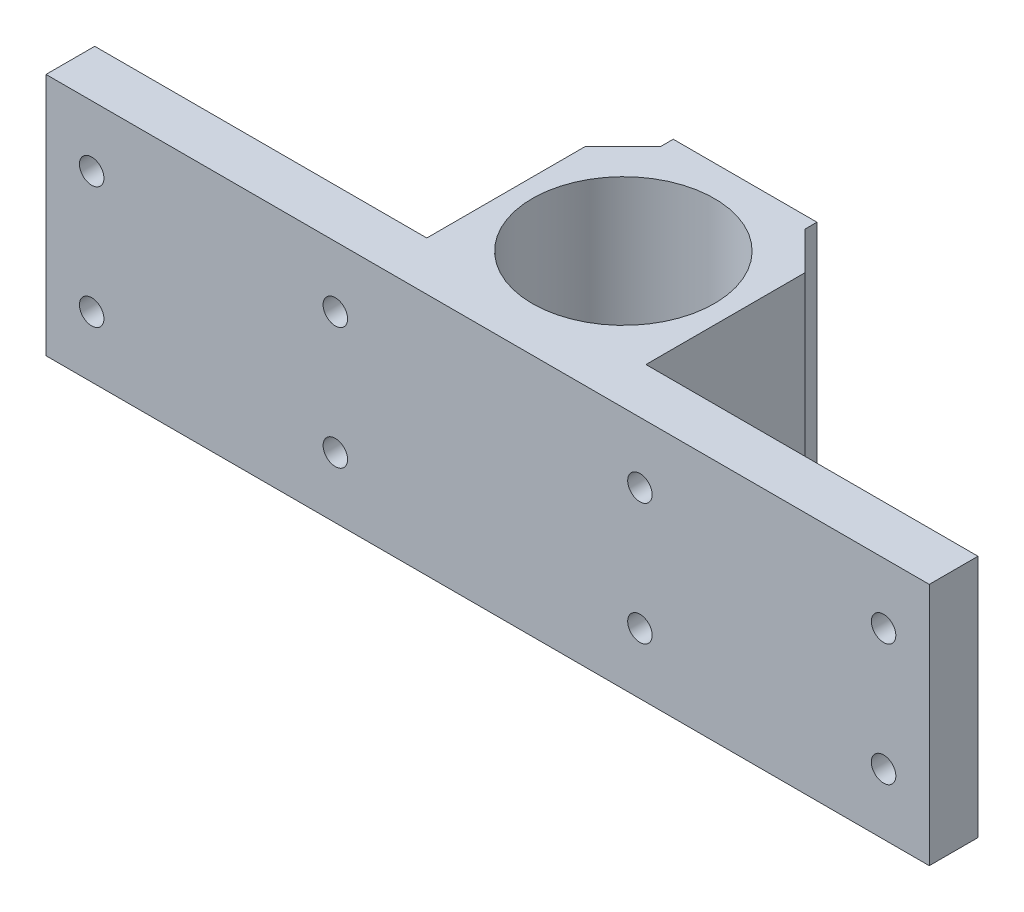
from build123d import *

# Parameters (mm, degrees)
SKETCH1_W                           = 184.15
SKETCH1_H                           = 50.8
BOSS_EXTRUDE1_DEPTH                 = 10.16
CUT_EXTRUDE1_DEPTH                  = 110.402922012
CUT_EXTRUDE1_DEPTH_BACK             = 110.402922012
SKETCH7_R                           = 22.847252038
BOSS_EXTRUDE2_DEPTH                 = 50.8
SKETCH8_R                           = 18.9865
CUT_EXTRUDE2_DEPTH                  = 45.72
SKETCH9_R                           = 7.9375
CUT_EXTRUDE3_DEPTH                  = 115.259711281
BOSS_EXTRUDE3_DEPTH                 = 50.8
BOSS_EXTRUDE4_START                 = -50.8
BOSS_EXTRUDE4_DEPTH                 = 50.8
BOSS_EXTRUDE5_START                 = -50.8
BOSS_EXTRUDE5_DEPTH                 = 50.8
CUT_EXTRUDE6_DEPTH                  = 117.385579957
F_10_CLEARANCE_HOLE1_D              = 5.1054
F_10_CLEARANCE_HOLE2_D              = 5.1054
SKETCH31_W                          = 29.960646913
SKETCH31_H                          = 50.8
BOSS_EXTRUDE6_DEPTH                 = 2.54
F_3_16_0_1875_DIAMETER_HOLE3_REACH  = 132.668
F_3_16_0_1875_DIAMETER_HOLE3_BORE_R = 2.38125
F_3_16_0_1875_DIAMETER_HOLE4_REACH  = 129.945
F_3_16_0_1875_DIAMETER_HOLE4_BORE_R = 2.38125


with BuildPart() as part:
    # Sketch1 → Boss-Extrude1 (new body)
    with BuildSketch(Plane.XY):
        with Locations((4.284398839, -3.653036721)):
            Rectangle(SKETCH1_W, SKETCH1_H)
    extrude(amount=BOSS_EXTRUDE1_DEPTH)

    # Sketch6 → Cut-Extrude1 (cut, two sides: drawn at the far end of the back side and taken through both)
    with BuildSketch(Plane(origin=(0, 21.746963279, 0), x_dir=(1, 0, 0), z_dir=(0, 1, 0)).offset(-CUT_EXTRUDE1_DEPTH_BACK)):
        with BuildLine():
            Line((189.051531618, 108.11571126), (10.888398839, 0))
            ThreePointArc((10.888398839, 0), (4.284398839, -1.847030056), (-2.319601161, 0))
            Line((-2.319601161, 0), (-180.48273394, 108.11571126))
            Line((-180.48273394, 108.11571126), (-180.48273394, 524.918345142))
            Line((-180.48273394, 524.918345142), (189.051531618, 524.918345142))
            Line((189.051531618, 524.918345142), (189.051531618, 108.11571126))
        make_face()
    extrude(amount=CUT_EXTRUDE1_DEPTH + CUT_EXTRUDE1_DEPTH_BACK, mode=Mode.SUBTRACT)

    # Sketch7 → Boss-Extrude2 (add, through all)
    with BuildSketch(Plane(origin=(0, 21.746963279, 0), x_dir=(1, 0, 0), z_dir=(0, 1, 0))):
        with Locations((4.284398839, 18.138470809)):
            Circle(SKETCH7_R)
    extrude(amount=-BOSS_EXTRUDE2_DEPTH)

    # Sketch8 → Cut-Extrude2 (cut)
    with BuildSketch(Plane(origin=(0, 21.746963279, 0), x_dir=(1, 0, 0), z_dir=(0, 1, 0))):
        with Locations(Location((4.284398839, 18.138470809, 0), (0, 0, 270))):
            Circle(SKETCH8_R)
    extrude(amount=-CUT_EXTRUDE2_DEPTH, mode=Mode.SUBTRACT)

    # Sketch9 → Cut-Extrude3 (cut, through all)
    with BuildSketch(Plane(origin=(0, -23.973036721, 0), x_dir=(1, 0, 0), z_dir=(0, 1, 0))):
        with Locations(Location((4.284398839, 18.138470809, 0), (0, 0, 270))):
            Circle(SKETCH9_R)
    extrude(amount=-CUT_EXTRUDE3_DEPTH, mode=Mode.SUBTRACT)

    # Sketch12 → Boss-Extrude3 (add)
    with BuildSketch(Plane(origin=(0, 21.746963279, 0), x_dir=(1, 0, 0), z_dir=(0, 1, 0))):
        with BuildLine():
            Line((27.131650877, 18.138470763), (27.131650877, 0))
            Line((27.131650877, 0), (18.176583779, 0))
            ThreePointArc((18.176583779, 0), (24.770920949, 8.024157287), (27.131650877, 18.138470763))
        make_face()
        with BuildLine():
            Line((-18.562853199, 18.138470775), (-18.562853199, 0))
            Line((-18.562853199, 0), (-9.607786101, 0))
            ThreePointArc((-9.607786101, 0), (-16.202123271, 8.024157294), (-18.562853199, 18.138470775))
        make_face()
    extrude(amount=-BOSS_EXTRUDE3_DEPTH)

    # Sketch16 → Boss-Extrude4 (add)
    with BuildSketch(Plane.XZ.offset(29.053036721).offset(BOSS_EXTRUDE4_START)):
        with BuildLine():
            Line((-18.562853199, -18.138470775), (-18.562853199, -40.985722847))
            Line((-18.562853199, -40.985722847), (4.284398845, -40.985722847))
            ThreePointArc((4.284398845, -40.985722847), (-11.871048017, -34.293917645), (-18.562853199, -18.138470775))
        make_face()
    extrude(amount=BOSS_EXTRUDE4_DEPTH)

    # Sketch18 → Boss-Extrude5 (add)
    with BuildSketch(Plane.XZ.offset(29.053036721).offset(BOSS_EXTRUDE5_START)):
        with BuildLine():
            Line((27.131650877, -18.138470763), (27.131650877, -40.985722847))
            Line((27.131650877, -40.985722847), (4.284398839, -40.985722847))
            ThreePointArc((4.284398839, -40.985722847), (20.439845703, -34.29391764), (27.131650877, -18.138470763))
        make_face()
    extrude(amount=BOSS_EXTRUDE5_DEPTH)

    # Sketch19 → Cut-Extrude6 (cut, through all)
    with BuildSketch(Plane(origin=(0, 21.746963279, 0), x_dir=(1, 0, 0), z_dir=(0, 1, 0))):
        Polygon((19.257650877, 40.985722847), (27.131650877, 40.985722847), (27.131650877, 33.111722847), align=None)
        Polygon((-18.562853199, 40.985722847), (-18.562853199, 33.125865684), (-10.702996036, 40.985722847), align=None)
    extrude(amount=-CUT_EXTRUDE6_DEPTH, mode=Mode.SUBTRACT)

    # #10 Clearance Hole1 (through all)
    with Locations(Plane(origin=(0, 0, 0), x_dir=(-1, 0, 0), z_dir=(0, 0, -1))):
        with Locations((78.265601161, 9.046963279), (78.265601161, -16.353036721), (-86.834398839, -16.353036721), (-86.834398839, 9.046963279)):
            Hole(F_10_CLEARANCE_HOLE1_D / 2)

    # #10 Clearance Hole2 (through all)
    with Locations(Plane(origin=(0, 0, 0), x_dir=(-1, 0, 0), z_dir=(0, 0, -1))):
        with Locations((27.465601161, -16.353036721), (27.465601161, 9.046963279), (-36.034398839, 9.046963279), (-36.034398839, -16.353036721)):
            Hole(F_10_CLEARANCE_HOLE2_D / 2)

    # Sketch31 → Boss-Extrude6 (add)
    with BuildSketch(Plane(origin=(0, 0, -40.985722847), x_dir=(-1, 0, 0), z_dir=(0, 0, -1))):
        with Locations((-4.27732742, -3.653036721)):
            Rectangle(SKETCH31_W, SKETCH31_H)
    extrude(amount=BOSS_EXTRUDE6_DEPTH)

    # 3/16 (0.1875) Diameter Hole3 bore → 3/16 (0.1875) Diameter Hole3 (cut, up to next)
    with BuildSketch(Plane(origin=(-25.844359441, 0, -25.844359441), x_dir=(-0.7071067811865462, 0, 0.7071067811865488), z_dir=(-0.7071067811865488, 0, -0.7071067811865462)), mode=Mode.PRIVATE) as f_3_16_0_1875_diameter_hole3_sk1:
        with Locations((-15.377604883, -20.163036721)):
            Circle(F_3_16_0_1875_DIAMETER_HOLE3_BORE_R)
    f_3_16_0_1875_diameter_hole3_tool1 = extrude(f_3_16_0_1875_diameter_hole3_sk1.sketch, amount=-F_3_16_0_1875_DIAMETER_HOLE3_REACH, mode=Mode.PRIVATE) & part.part
    # 3/16 (0.1875) Diameter Hole3 bore → 3/16 (0.1875) Diameter Hole3 (cut, up to next)
    with BuildSketch(Plane(origin=(-25.844359441, 0, -25.844359441), x_dir=(-0.7071067811865462, 0, 0.7071067811865488), z_dir=(-0.7071067811865488, 0, -0.7071067811865462)), mode=Mode.PRIVATE) as f_3_16_0_1875_diameter_hole3_sk2:
        with Locations((-15.377604883, -7.463036721)):
            Circle(F_3_16_0_1875_DIAMETER_HOLE3_BORE_R)
    f_3_16_0_1875_diameter_hole3_tool2 = extrude(f_3_16_0_1875_diameter_hole3_sk2.sketch, amount=-F_3_16_0_1875_DIAMETER_HOLE3_REACH, mode=Mode.PRIVATE) & part.part
    add(f_3_16_0_1875_diameter_hole3_tool1.solids().sort_by_distance((-14.970751, -20.163037, -36.717968))[0], mode=Mode.SUBTRACT)
    add(f_3_16_0_1875_diameter_hole3_tool2.solids().sort_by_distance((-14.970751, -7.463037, -36.717968))[0], mode=Mode.SUBTRACT)

    # 3/16 (0.1875) Diameter Hole4 bore → 3/16 (0.1875) Diameter Hole4 (cut, up to next)
    with BuildSketch(Plane(origin=(30.121686862, 0, -30.121686862), x_dir=(-0.7071067811865562, 0, -0.7071067811865389), z_dir=(0.7071067811865389, 0, -0.7071067811865562)), mode=Mode.PRIVATE) as f_3_16_0_1875_diameter_hole4_sk1:
        with Locations((9.308549442, -20.163036721)):
            Circle(F_3_16_0_1875_DIAMETER_HOLE4_BORE_R)
    f_3_16_0_1875_diameter_hole4_tool1 = extrude(f_3_16_0_1875_diameter_hole4_sk1.sketch, amount=-F_3_16_0_1875_DIAMETER_HOLE4_REACH, mode=Mode.PRIVATE) & part.part
    # 3/16 (0.1875) Diameter Hole4 bore → 3/16 (0.1875) Diameter Hole4 (cut, up to next)
    with BuildSketch(Plane(origin=(30.121686862, 0, -30.121686862), x_dir=(-0.7071067811865562, 0, -0.7071067811865389), z_dir=(0.7071067811865389, 0, -0.7071067811865562)), mode=Mode.PRIVATE) as f_3_16_0_1875_diameter_hole4_sk2:
        with Locations((9.308549442, -7.463036721)):
            Circle(F_3_16_0_1875_DIAMETER_HOLE4_BORE_R)
    f_3_16_0_1875_diameter_hole4_tool2 = extrude(f_3_16_0_1875_diameter_hole4_sk2.sketch, amount=-F_3_16_0_1875_DIAMETER_HOLE4_REACH, mode=Mode.PRIVATE) & part.part
    add(f_3_16_0_1875_diameter_hole4_tool1.solids().sort_by_distance((23.539548, -20.163037, -36.703825))[0], mode=Mode.SUBTRACT)
    add(f_3_16_0_1875_diameter_hole4_tool2.solids().sort_by_distance((23.539548, -7.463037, -36.703825))[0], mode=Mode.SUBTRACT)


solid = part.part
